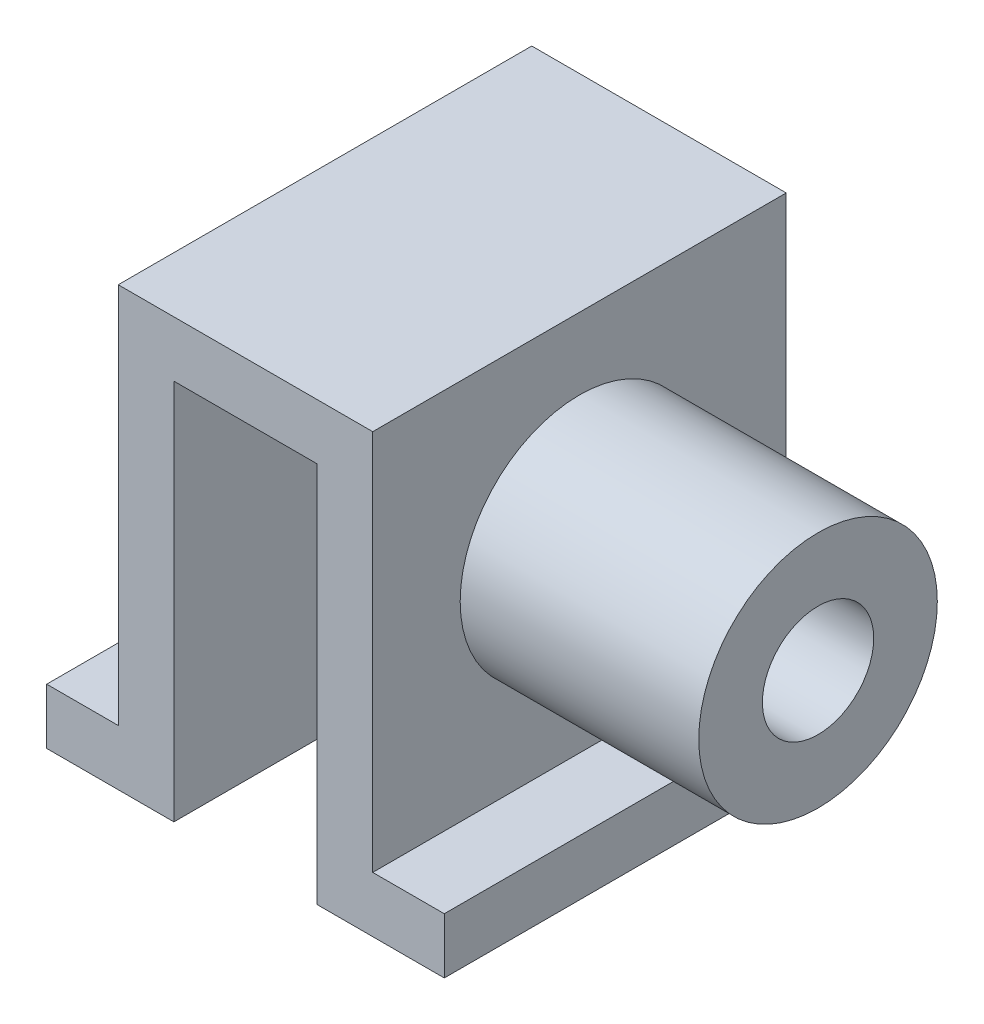
from build123d import *

# Parameters (mm, degrees)
BOSS_EXTRUDE1_DEPTH = 26
SKETCH2_R           = 15
SKETCH2_R_2         = 7
BOSS_EXTRUDE2_DEPTH = 30
CUT_EXTRUDE1_REACH  = 75.362
SKETCH3_R           = 7


with BuildPart() as part:
    # Sketch1 → Boss-Extrude1 (new, symmetric)
    with BuildSketch(Plane.XY):
        Polygon((-25, 0), (-9, 0), (-9, 7), (-9, 48), (9, 48), (9, 7), (9, 0), (25, 0), (25, 7), (16, 7), (16, 48), (16, 55), (-16, 55), (-16, 48), (-16, 7), (-25, 7), align=None)
    extrude(amount=BOSS_EXTRUDE1_DEPTH, both=True)

    # Sketch2 → Boss-Extrude2 (add)
    with BuildSketch(Plane(origin=(16, 0, 0), x_dir=(0, 0, -1), z_dir=(1, 0, 0))):
        with Locations(Location((0, 31, 0), (0, 0, 270))):
            Circle(SKETCH2_R)
        with Locations(Location((0, 31, 0), (0, 0, 90))):
            Circle(SKETCH2_R_2, mode=Mode.SUBTRACT)
    extrude(amount=BOSS_EXTRUDE2_DEPTH)

    # Sketch3 → Cut-Extrude1 (cut, up to next)
    with BuildSketch(Plane(origin=(16, 0, 0), x_dir=(0, 0, -1), z_dir=(1, 0, 0)), mode=Mode.PRIVATE) as cut_extrude1_sk1:
        with Locations((0, 31)):
            Circle(SKETCH3_R)
    cut_extrude1_tool1 = extrude(cut_extrude1_sk1.sketch, amount=-CUT_EXTRUDE1_REACH, mode=Mode.PRIVATE) & part.part
    add(cut_extrude1_tool1.solids().sort_by_distance((16, 31, 0))[0], mode=Mode.SUBTRACT)


solid = part.part
